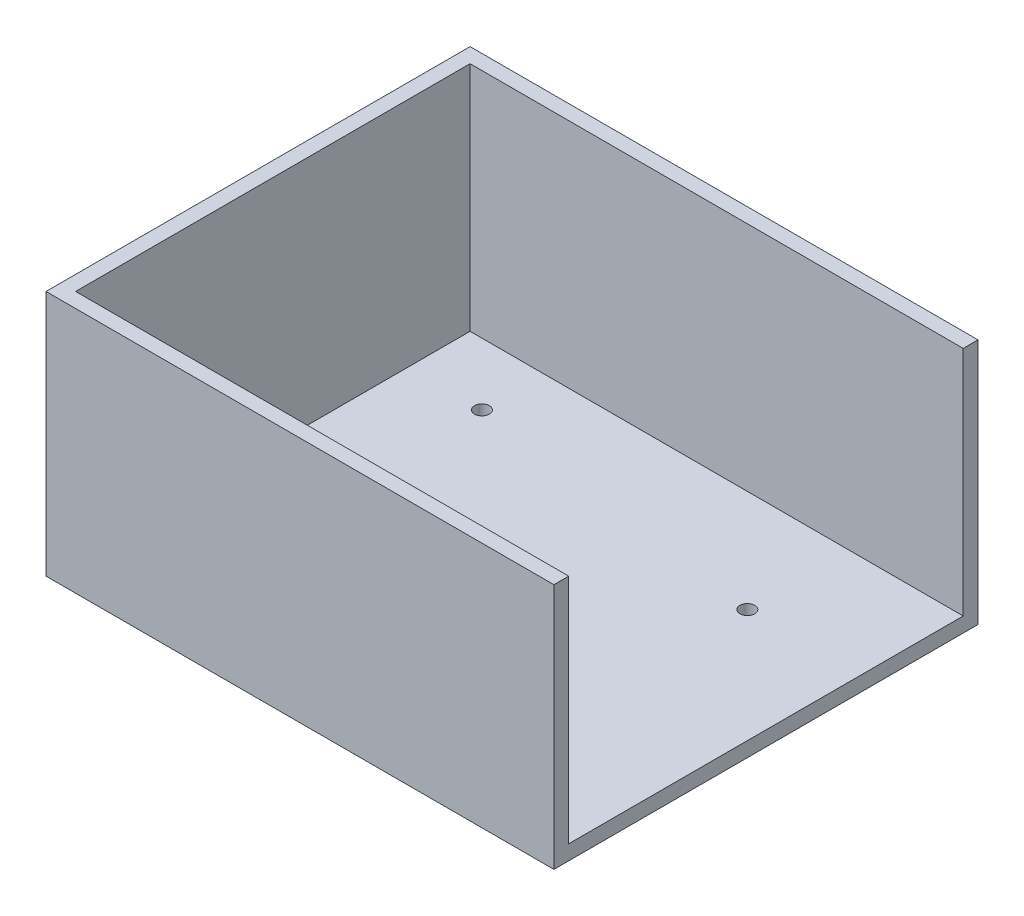
from build123d import *

# Parameters (mm, degrees)
SCHIZZO1_W                   = 100
SCHIZZO1_H                   = 80
SCHIZZO1_R                   = 1.5
ESTRUSIONE_ESTRUSIONE1_DEPTH = 3
SCHIZZO2_W                   = 100
SCHIZZO2_H                   = 50
ESTRUSIONE_ESTRUSIONE2_DEPTH = 3
SCHIZZO3_W                   = 86
SCHIZZO3_H                   = 50
ESTRUSIONE_ESTRUSIONE3_DEPTH = 3


with BuildPart() as part:
    # Schizzo1 → Estrusione-Estrusione1 (new body)
    with BuildSketch(Plane(origin=(0, 0, 0), x_dir=(1, 0, 0), z_dir=(0, 1, 0))):
        with Locations((50, 40)):
            Rectangle(SCHIZZO1_W, SCHIZZO1_H)
        with Locations(Location((15, 67.4, 0), (0, 0, 270))):
            Circle(SCHIZZO1_R, mode=Mode.SUBTRACT)
        with Locations(Location((15, 12.6, 0), (0, 0, 90))):
            Circle(SCHIZZO1_R, mode=Mode.SUBTRACT)
        with Locations(Location((76.978953205, 59.25, 0), (0, 0, 270))):
            Circle(SCHIZZO1_R, mode=Mode.SUBTRACT)
        with Locations(Location((76.978953205, 20.75, 0), (0, 0, 90))):
            Circle(SCHIZZO1_R, mode=Mode.SUBTRACT)
    extrude(amount=ESTRUSIONE_ESTRUSIONE1_DEPTH)

    # Schizzo2 → Estrusione-Estrusione2 (add)
    with BuildSketch(Plane.XY):
        with Locations((50, 25)):
            Rectangle(SCHIZZO2_W, SCHIZZO2_H)
    estrusione_estrusione2 = extrude(amount=ESTRUSIONE_ESTRUSIONE2_DEPTH)

    # Specchia1: Estrusione-Estrusione2 across plane
    add(estrusione_estrusione2.mirror(Plane.XY.offset(-40)))

    # Schizzo3 → Estrusione-Estrusione3 (add)
    with BuildSketch(Plane.ZY):
        with Locations((-40, 25)):
            Rectangle(SCHIZZO3_W, SCHIZZO3_H)
    extrude(amount=ESTRUSIONE_ESTRUSIONE3_DEPTH)


solid = part.part
